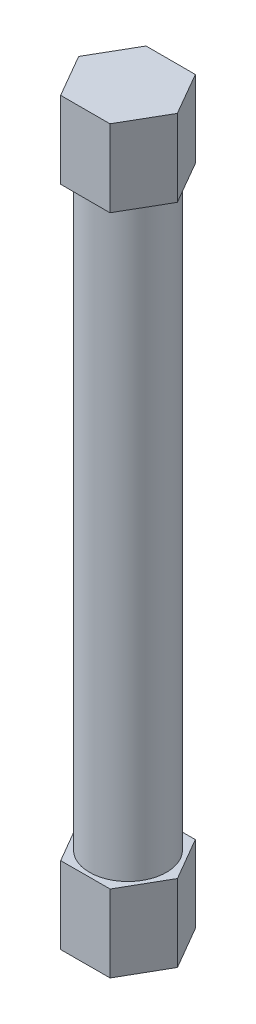
from build123d import *

# Parameters (mm, degrees)
SKETCH1_R           = 2.5
BOSS_EXTRUDE1_DEPTH = 38
BOSS_EXTRUDE2_DEPTH = 5
BOSS_EXTRUDE3_DEPTH = 5


with BuildPart() as part:
    # Sketch1 → Boss-Extrude1 (new body)
    with BuildSketch(Plane(origin=(0, 0, 0), x_dir=(1, 0, 0), z_dir=(0, 1, 0))):
        with Locations(Location((0, 0, 0), (0, 0, 270))):
            Circle(SKETCH1_R)
    extrude(amount=BOSS_EXTRUDE1_DEPTH)

    # Sketch2 → Boss-Extrude2 (add)
    with BuildSketch(Plane(origin=(0, 38, 0), x_dir=(1, 0, 0), z_dir=(0, 1, 0))):
        Polygon((3.2, 0), (1.6, 2.771281292), (-1.6, 2.771281292), (-3.2, 0), (-1.6, -2.771281292), (1.6, -2.771281292), align=None)
    extrude(amount=BOSS_EXTRUDE2_DEPTH)

    # Sketch3 → Boss-Extrude3 (add)
    with BuildSketch(Plane.XZ):
        Polygon((3.199985384, -0.009671706), (1.608368635, 2.766432781), (-1.591616749, 2.776104487), (-3.199985384, 0.009671706), (-1.608368635, -2.766432781), (1.591616749, -2.776104487), align=None)
    extrude(amount=BOSS_EXTRUDE3_DEPTH)


solid = part.part
